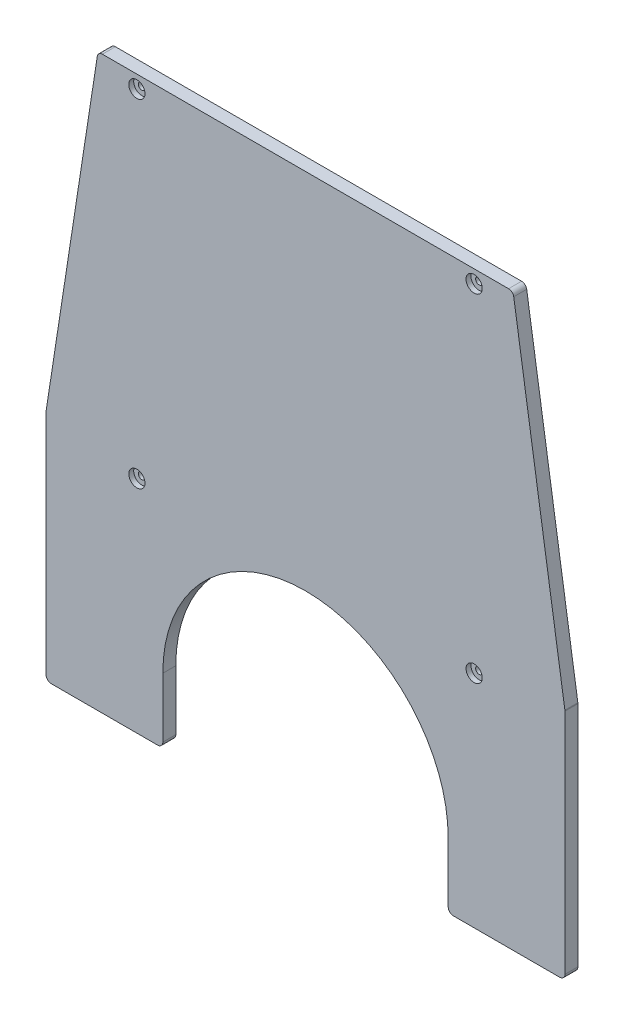
from build123d import *

# Parameters (mm, degrees)
SKETCH1_W                                    = 114.3
SKETCH1_H                                    = 63.5
BOSS_EXTRUDE3_DEPTH                          = 12.7
FILLET1_R                                    = 5.08
CBORE_FOR_1_4_HEX_MACHINE_SCREW1_D           = 6.7564
CBORE_FOR_1_4_HEX_MACHINE_SCREW1_CBORE_D     = 15.875
CBORE_FOR_1_4_HEX_MACHINE_SCREW1_CBORE_DEPTH = 4.826


with BuildPart() as part:
    # Sketch1 → Boss-Extrude3 (new body)
    with BuildSketch(Plane.XY):
        with BuildLine():
            ThreePointArc((-139.7, 0), (-98.782817332, 98.782817332), (0, 139.7))
            Line((0, 139.7), (0, 495.3))
            Line((0, 495.3), (-203.2, 495.3))
            Line((-203.2, 495.3), (-254, 165.1))
            Line((-254, 165.1), (-254, 0))
            Line((-254, 0), (-139.7, 0))
        make_face()
        with Locations((-196.85, -31.75)):
            Rectangle(SKETCH1_W, SKETCH1_H)
        with BuildLine():
            ThreePointArc((0, 139.7), (98.782817332, 98.782817332), (139.7, 0))
            Line((139.7, 0), (254, 0))
            Line((254, 0), (254, 165.1))
            Line((254, 165.1), (203.2, 495.3))
            Line((203.2, 495.3), (0, 495.3))
            Line((0, 495.3), (0, 139.7))
        make_face()
        with Locations((196.85, -31.75)):
            Rectangle(SKETCH1_W, SKETCH1_H)
    extrude(amount=BOSS_EXTRUDE3_DEPTH)

    # Fillet1
    fillet1_edges = [part.edges().sort_by_distance(p)[0] for p in [
        (-139.7, -63.5, 6.35),
        (-254, -63.5, 6.35),
        (-254, 165.1, 6.35),
        (-203.2, 495.3, 6.35),
        (203.2, 495.3, 6.35),
        (254, 165.1, 6.35),
        (254, -63.5, 6.35),
        (139.7, -63.5, 6.35),
    ]]
    fillet(fillet1_edges, radius=FILLET1_R)

    # CBORE for 1/4 Hex Machine Screw1 (through all)
    with Locations(Plane.XY.offset(12.7)):
        with Locations((165.1, 482.6), (165.1, 152.4), (-165.1, 152.4), (-165.1, 482.6)):
            CounterBoreHole(CBORE_FOR_1_4_HEX_MACHINE_SCREW1_D / 2, CBORE_FOR_1_4_HEX_MACHINE_SCREW1_CBORE_D / 2, CBORE_FOR_1_4_HEX_MACHINE_SCREW1_CBORE_DEPTH)


solid = part.part
